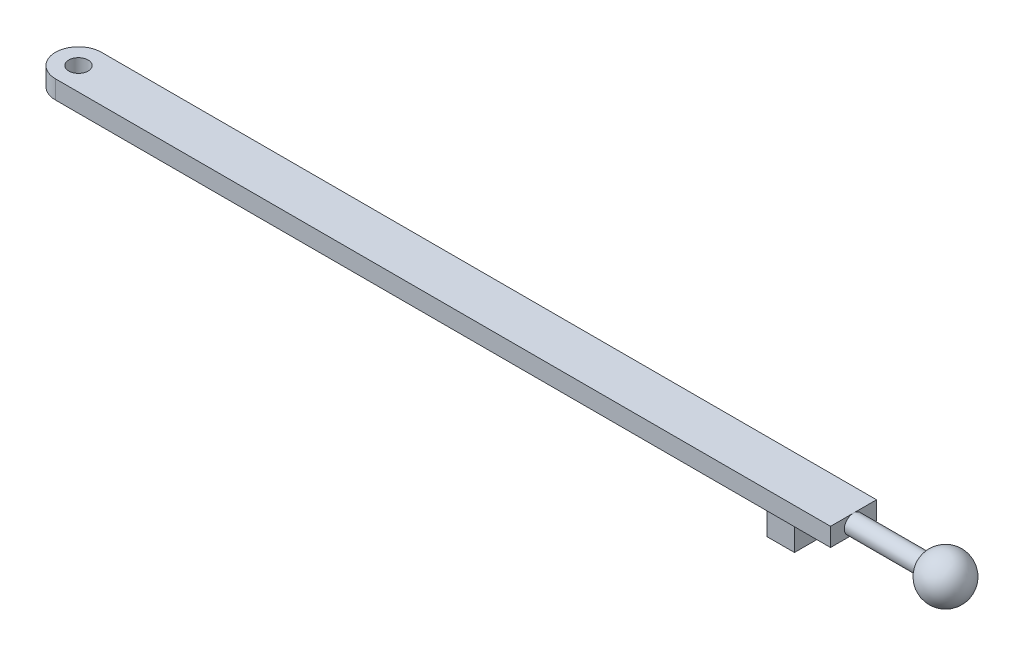
from build123d import *

# Parameters (mm, degrees)
SKETCH1_R               = 1
BOSS_EXTRUDE1_DEPTH     = 2
SKETCH4_R               = 1
BOSS_EXTRUDE2_DEPTH     = 11
SKETCH11_W              = 0.548452347
SKETCH11_H              = 0.731269796
BOSS_EXTRUDE3_DEPTH     = 1
SKETCH12_W              = 2.985960681
SKETCH12_H              = 2.799338139
BOSS_EXTRUDE4_DEPTH     = 3
SKETCH15_W              = 5
SKETCH15_H              = 2
BOSS_EXTRUDE5_DEPTH     = 86.79
CUT_EXTRUDE4_DEPTH      = 87.918088451
CUT_EXTRUDE4_DEPTH_BACK = 87.918088451
CUT_EXTRUDE5_DEPTH      = 88.033063258
CUT_EXTRUDE5_DEPTH_BACK = 88.033063258
SKETCH19_R              = 1.05
CUT_EXTRUDE7_DEPTH      = 87.918088451
CUT_EXTRUDE7_DEPTH_BACK = 87.918088451


with BuildPart() as part:
    # Sketch1 → Boss-Extrude1 (new body)
    with BuildSketch(Plane(origin=(0, 0, 0), x_dir=(1, 0, 0), z_dir=(0, 1, 0))):
        with BuildLine():
            Line((-10, 2.5), (0, 2.5))
            Line((0, 2.5), (0, -2.5))
            Line((0, -2.5), (-10, -2.5))
            ThreePointArc((-10, -2.5), (-12.5, 0), (-10, 2.5))
        make_face()
        with Locations((-10, 0)):
            Circle(SKETCH1_R, mode=Mode.SUBTRACT)
    extrude(amount=BOSS_EXTRUDE1_DEPTH)

    # Sketch4 → Boss-Extrude2 (add)
    with BuildSketch(Plane(origin=(0, 0, 0), x_dir=(0, 0, -1), z_dir=(1, 0, 0))):
        with Locations((0, 1)):
            Circle(SKETCH4_R)
    extrude(amount=BOSS_EXTRUDE2_DEPTH)

    # Sketch11 → Boss-Extrude3 (add)
    with BuildSketch(Plane.XZ):
        with Locations((-7.723091918, 0.104467114)):
            Rectangle(SKETCH11_W, SKETCH11_H)
    extrude(amount=BOSS_EXTRUDE3_DEPTH)

    # Sketch12 → Boss-Extrude4 (add)
    with BuildSketch(Plane.XZ.offset(1)):
        with Locations((-6.985405351, -0.467965971)):
            Rectangle(SKETCH12_W, SKETCH12_H)
    extrude(amount=BOSS_EXTRUDE4_DEPTH)

    # Sketch15 → Boss-Extrude5 (add)
    with BuildSketch(Plane(origin=(0, 0, 0), x_dir=(0, 0, -1), z_dir=(1, 0, 0))):
        with Locations((0, 1)):
            Rectangle(SKETCH15_W, SKETCH15_H)
    extrude(amount=-BOSS_EXTRUDE5_DEPTH)

    # Sketch16 → Cut-Extrude4 (cut, two sides: drawn at the far end of the back side and taken through both)
    with BuildSketch(Plane.XZ.offset(-CUT_EXTRUDE4_DEPTH_BACK)):
        with BuildLine():
            ThreePointArc((-84.29, -2.5), (-86.057766953, -1.767766953), (-86.79, 0))
            Line((-86.79, 0), (-86.79, -2.5))
            Line((-86.79, -2.5), (-84.29, -2.5))
        make_face()
    extrude(amount=CUT_EXTRUDE4_DEPTH + CUT_EXTRUDE4_DEPTH_BACK, mode=Mode.SUBTRACT)

    # Sketch19 → Cut-Extrude5 (cut, two sides: drawn at the far end of the back side and taken through both)
    with BuildSketch(Plane(origin=(0, 2, 0), x_dir=(1, 0, 0), z_dir=(0, 1, 0)).offset(-CUT_EXTRUDE5_DEPTH_BACK)):
        with Locations((-84.29, 0)):
            Circle(SKETCH19_R)
    extrude(amount=CUT_EXTRUDE5_DEPTH + CUT_EXTRUDE5_DEPTH_BACK, mode=Mode.SUBTRACT)

    # Sketch16<4> → Cut-Extrude7 (cut, two sides: drawn at the far end of the back side and taken through both)
    with BuildSketch(Plane.XZ.offset(-CUT_EXTRUDE7_DEPTH_BACK)):
        with BuildLine():
            Line((-86.79, 2.5), (-86.79, 0))
            ThreePointArc((-86.79, 0), (-86.057766953, 1.767766953), (-84.29, 2.5))
            Line((-84.29, 2.5), (-86.79, 2.5))
        make_face()
    extrude(amount=CUT_EXTRUDE7_DEPTH + CUT_EXTRUDE7_DEPTH_BACK, mode=Mode.SUBTRACT)

    # Sketch20 → Revolve1 (revolve)
    with BuildSketch(Plane(origin=(0, 1, 0), x_dir=(-1, 0, 0), z_dir=(0, -1, 0))):
        with BuildLine():
            ThreePointArc((-7.5, 0), (-10, 2.5), (-12.5, 0))
            Line((-12.5, 0), (-7.5, 0))
        make_face()
    revolve(axis=Axis((12.5, 1, 0), (-1, 0, 0)))


solid = part.part
